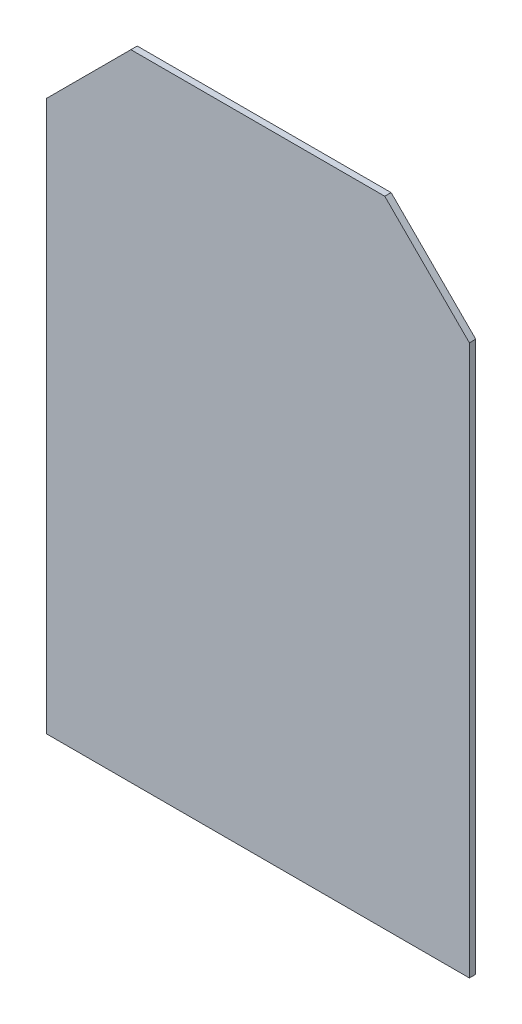
from build123d import *

# Parameters (mm, degrees)
SKETCH_1_W      = 20
SKETCH_1_H      = 30
EXTRUDE_1_DEPTH = 0.3
CHAMFER_1_SIZE  = 4


with BuildPart() as part:
    # 草图1 → 凸台-拉伸1 (new body)
    with BuildSketch(Plane.XY):
        Rectangle(SKETCH_1_W, SKETCH_1_H)
    extrude(amount=EXTRUDE_1_DEPTH)

    # 倒角1
    chamfer_1_edges = [part.edges().sort_by_distance(p)[0] for p in [
        (-10, 15, 0.15),
        (10, 15, 0.15),
    ]]
    chamfer(chamfer_1_edges, length=CHAMFER_1_SIZE)


solid = part.part
